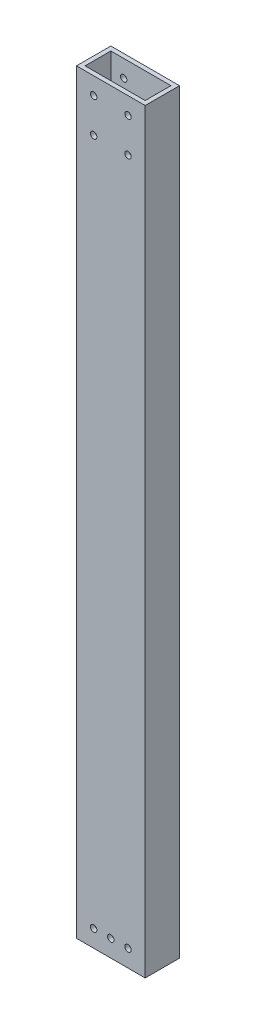
from build123d import *

# Parameters (mm, degrees)
SKETCH1_W           = 50.8
SKETCH1_H           = 25.4
BOSS_EXTRUDE1_DEPTH = 279.4
SHELL1_T            = -3.175
SKETCH2_R           = 2.38125
CUT_EXTRUDE1_DEPTH  = 282.699627263


with BuildPart() as part:
    # Sketch1 → Boss-Extrude1 (new, symmetric)
    with BuildSketch(Plane(origin=(0, 0, 0), x_dir=(1, 0, 0), z_dir=(0, 1, 0))):
        Rectangle(SKETCH1_W, SKETCH1_H)
    extrude(amount=BOSS_EXTRUDE1_DEPTH, both=True)

    # Shell1
    shell1_openings = [part.faces().sort_by_distance(p)[0] for p in [
        (0, 279.4, 0),
        (0, -279.4, 0),
    ]]
    offset(amount=SHELL1_T, openings=shell1_openings, kind=Kind.INTERSECTION)

    # Sketch2 → Cut-Extrude1 (cut, through all)
    with BuildSketch(Plane(origin=(0, 0, -12.7), x_dir=(-1, 0, 0), z_dir=(0, 0, -1))):
        with Locations((-12.7, -266.7)):
            Circle(SKETCH2_R)
        with Locations((0, -266.7)):
            Circle(SKETCH2_R)
        with Locations((12.7, -266.7)):
            Circle(SKETCH2_R)
        with Locations((-12.7, 266.7)):
            Circle(SKETCH2_R)
        with Locations((-12.7, 241.3)):
            Circle(SKETCH2_R)
        with Locations((12.7, 241.3)):
            Circle(SKETCH2_R)
        with Locations((12.7, 266.7)):
            Circle(SKETCH2_R)
    extrude(amount=-CUT_EXTRUDE1_DEPTH, mode=Mode.SUBTRACT)


solid = part.part
